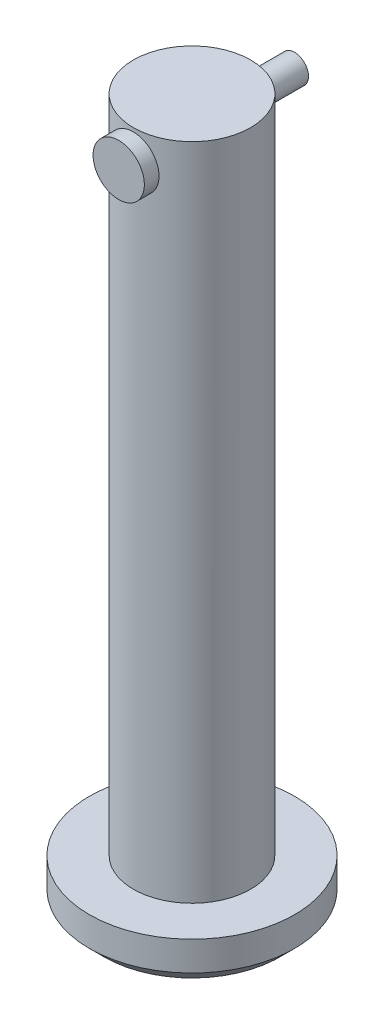
from build123d import *

# Parameters (mm, degrees)
SKETCH1_R                = 4
BOSS_EXTRUDE1_DEPTH      = 45
SKETCH2_R                = 7
BOSS_EXTRUDE2_DEPTH      = 3
CHAMFER1_SIZE            = 1
CUT_EXTRUDE1_DEPTH       = 10
CUT_EXTRUDE1_DEPTH_BACK  = 10
SKETCH3_R                = 1
BOSS_EXTRUDE3_DEPTH      = 5
BOSS_EXTRUDE3_DEPTH_BACK = 7
SKETCH4_R                = 0.95
SKETCH5_R                = 1.75
BOSS_EXTRUDE4_DEPTH      = 1


with BuildPart() as part:
    # Sketch1 → Boss-Extrude1 (new body)
    with BuildSketch(Plane(origin=(0, 0, 0), x_dir=(1, 0, 0), z_dir=(0, 1, 0))):
        Circle(SKETCH1_R)
    extrude(amount=BOSS_EXTRUDE1_DEPTH)

    # Sketch2 → Boss-Extrude2 (add)
    with BuildSketch(Plane.XZ):
        Circle(SKETCH2_R)
    extrude(amount=BOSS_EXTRUDE2_DEPTH)

    # Chamfer1
    chamfer1_edges = [part.edges().sort_by_distance(p)[0] for p in [
        (-7, -3, 0),
    ]]
    chamfer(chamfer1_edges, length=CHAMFER1_SIZE)

    # Sketch3 → Cut-Extrude1 (cut, two sides: drawn at the far end of the back side and taken through both)
    with BuildSketch(Plane.XY.offset(-CUT_EXTRUDE1_DEPTH_BACK)):
        with Locations((0, 43)):
            Circle(SKETCH3_R)
    extrude(amount=CUT_EXTRUDE1_DEPTH + CUT_EXTRUDE1_DEPTH_BACK, mode=Mode.SUBTRACT)


with BuildPart() as body_2:
    # Sketch4 → Boss-Extrude3 (new, two sides: drawn at the far end of the back side and taken through both)
    with BuildSketch(Plane.XY.offset(-BOSS_EXTRUDE3_DEPTH_BACK)):
        with Locations((0, 43)):
            Circle(SKETCH4_R)
    extrude(amount=BOSS_EXTRUDE3_DEPTH + BOSS_EXTRUDE3_DEPTH_BACK)

    # Sketch5 → Boss-Extrude4 (add)
    with BuildSketch(Plane.XY.offset(5)):
        with Locations((0, 43)):
            Circle(SKETCH5_R)
    extrude(amount=-BOSS_EXTRUDE4_DEPTH)


solid = Compound([part.part, body_2.part])
